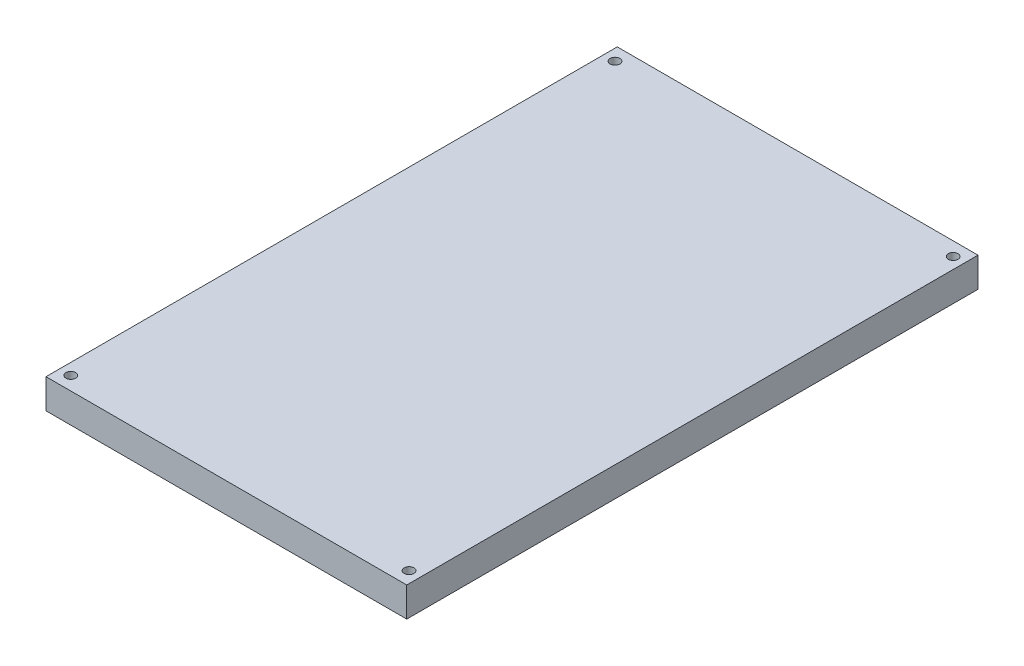
from build123d import *

# Parameters (mm, degrees)
SKETCH1_W           = 121.92
SKETCH1_H           = 193.0654
SKETCH1_R           = 1.651
BOSS_EXTRUDE1_DEPTH = 10


with BuildPart() as part:
    # Sketch1 → Boss-Extrude1 (new body)
    with BuildSketch(Plane(origin=(0, 0, 0), x_dir=(1, 0, 0), z_dir=(0, 1, 0))):
        Rectangle(SKETCH1_W, SKETCH1_H)
        with Locations(Location((-57.15, -91.9607, 0), (0, 0, 270))):
            Circle(SKETCH1_R, mode=Mode.SUBTRACT)
        with Locations(Location((57.15, -91.948, 0), (0, 0, 90))):
            Circle(SKETCH1_R, mode=Mode.SUBTRACT)
        with Locations(Location((57.15, 91.948, 0), (0, 0, 270))):
            Circle(SKETCH1_R, mode=Mode.SUBTRACT)
        with Locations(Location((-57.15, 91.948, 0), (0, 0, 90))):
            Circle(SKETCH1_R, mode=Mode.SUBTRACT)
    extrude(amount=BOSS_EXTRUDE1_DEPTH)


solid = part.part
